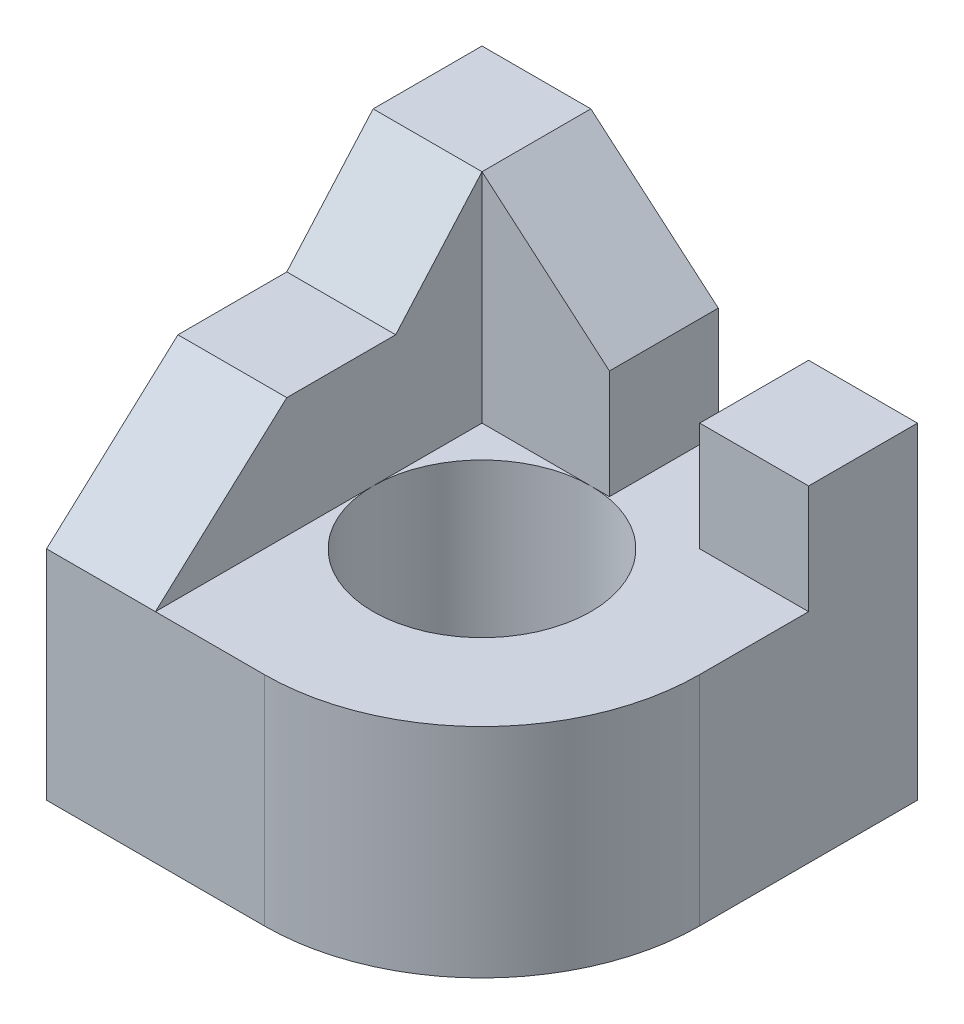
from build123d import *

# Parameters (mm, degrees)
EXTRUDE_1_DEPTH     = 2
SKETCH_2_W          = 1
SKETCH_2_H          = 1
EXTRUDE_2_DEPTH     = 1
EXTRUDE_3_DEPTH     = 1
SKETCH_4_R          = 1
CUT_EXTRUDE_1_DEPTH = 3


with BuildPart() as part:
    # 草圖1 → 填料-伸長1 (new body)
    with BuildSketch(Plane(origin=(0, 0, 0), x_dir=(1, 0, 0), z_dir=(0, 1, 0))):
        with BuildLine():
            Line((0, 0), (4, 0))
            Line((4, 0), (4, -2))
            ThreePointArc((4, -2), (3.414213562, -3.414213562), (2, -4))
            Line((2, -4), (0, -4))
            Line((0, -4), (0, 0))
        make_face()
    extrude(amount=EXTRUDE_1_DEPTH)

    # 草圖2 → 填料-伸長2 (add)
    with BuildSketch(Plane(origin=(0, 0, 0), x_dir=(-1, 0, 0), z_dir=(0, 0, -1))):
        with Locations((-3.5, 2.5)):
            Rectangle(SKETCH_2_W, SKETCH_2_H)
        Polygon((0, 2), (0, 4), (-1, 4), (-2.170585106, 3), (-2.170585106, 2), (-1.48690172, 2), align=None)
    extrude(amount=-EXTRUDE_2_DEPTH)

    # 草圖3 → 填料-伸長3 (add)
    with BuildSketch(Plane.ZY):
        Polygon((1, 4), (1.793034804, 3.099332456), (2.793034804, 3.099332456), (4, 2), (1, 2), align=None)
    extrude(amount=-EXTRUDE_3_DEPTH)

    # 草圖4 → 除料-伸長1 (cut)
    with BuildSketch(Plane(origin=(0, 2, 0), x_dir=(1, 0, 0), z_dir=(0, 1, 0))):
        with Locations(Location((2, -2, 0), (0, 0, 90))):
            Circle(SKETCH_4_R)
    extrude(amount=-CUT_EXTRUDE_1_DEPTH, mode=Mode.SUBTRACT)


solid = part.part
